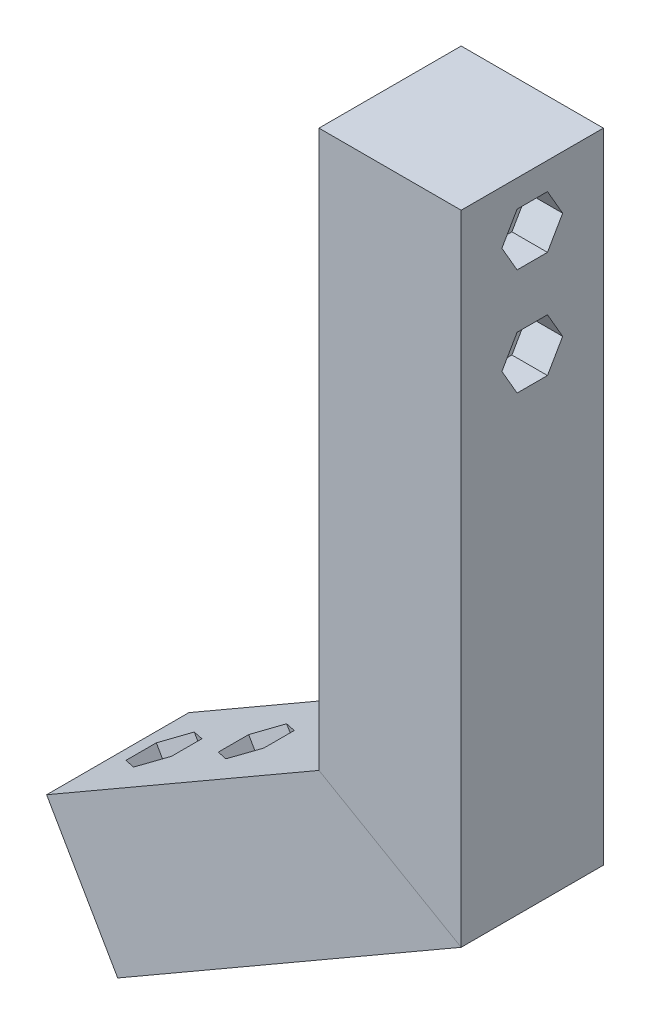
from build123d import *

# Parameters (mm, degrees)
SKETCH4_W          = 20
SKETCH4_H          = 20
CUT_EXTRUDE1_REACH = 118.478
SKETCH5_R          = 2
SKETCH5_3_R        = 2
CUT_EXTRUDE2_DEPTH = 5
SKETCH6_R          = 2
CUT_EXTRUDE3_DEPTH = 139.877964102
SKETCH6_5_R        = 2
CUT_EXTRUDE4_DEPTH = 5


with BuildPart() as part:
    # Sweep1: sweep along a path in Sketch1
    with BuildLine(Plane.XY) as sweep1_path:
        Line((0, 0), (43.301270189, 25))
        Line((43.301270189, 25), (43.301270189, 109))
    # Sketch4 → Sweep1 (sweep)
    with BuildSketch(Plane(origin=(0, 0, 0), x_dir=(0, 0, 1), z_dir=(-0.866025403784438, -0.5000000000000012, 0))):
        Rectangle(SKETCH4_W, SKETCH4_H)
    sweep(path=sweep1_path.line, transition=Transition.RIGHT)

    # Sketch5 → Cut-Extrude1 (cut, up to next)
    with BuildSketch(Plane(origin=(-5, 8.660254038, 0), x_dir=(0.866025403784438, 0.5000000000000012, 0), z_dir=(-0.5000000000000012, 0.866025403784438, 0)), mode=Mode.PRIVATE) as cut_extrude1_sk1:
        with Locations(Location((7.5, 0, 0), (0, 0, 180))):
            Circle(SKETCH5_R)
    cut_extrude1_tool1 = extrude(cut_extrude1_sk1.sketch, amount=-CUT_EXTRUDE1_REACH, mode=Mode.PRIVATE) & part.part
    # Sketch5 → Cut-Extrude1 (cut, up to next)
    with BuildSketch(Plane(origin=(-5, 8.660254038, 0), x_dir=(0.866025403784438, 0.5000000000000012, 0), z_dir=(-0.5000000000000012, 0.866025403784438, 0)), mode=Mode.PRIVATE) as cut_extrude1_sk2:
        with Locations(Location((22.5, 0, 0), (0, 0, 180))):
            Circle(SKETCH5_R)
    cut_extrude1_tool2 = extrude(cut_extrude1_sk2.sketch, amount=-CUT_EXTRUDE1_REACH, mode=Mode.PRIVATE) & part.part
    add(cut_extrude1_tool1.solids().sort_by_distance((1.495191, 12.410254, 0))[0], mode=Mode.SUBTRACT)
    add(cut_extrude1_tool2.solids().sort_by_distance((14.485572, 19.910254, 0))[0], mode=Mode.SUBTRACT)

    # Sketch5<3> → Cut-Extrude2 (cut)
    # profile 1 of 2: a face of its own
    with BuildSketch(Plane(origin=(-5, 8.660254038, 0), x_dir=(0.866025403784438, 0.5000000000000012, 0), z_dir=(-0.5000000000000012, 0.866025403784438, 0))):
        Polygon((11.2, -2.136195996), (11.2, 2.136195996), (7.5, 4.272391992), (3.8, 2.136195996), (3.8, -2.136195996), (7.5, -4.272391992), align=None)
        with Locations(Location((7.5, 0, 0), (0, 0, 180))):
            Circle(SKETCH5_3_R, mode=Mode.SUBTRACT)
    # profile 2 of 2: a face of its own
    with BuildSketch(Plane(origin=(-5, 8.660254038, 0), x_dir=(0.866025403784438, 0.5000000000000012, 0), z_dir=(-0.5000000000000012, 0.866025403784438, 0))):
        Polygon((26.2, -2.136195996), (26.2, 2.136195996), (22.5, 4.272391992), (18.8, 2.136195996), (18.8, -2.136195996), (22.5, -4.272391992), align=None)
        with Locations(Location((22.5, 0, 0), (0, 0, 180))):
            Circle(SKETCH5_3_R, mode=Mode.SUBTRACT)
    extrude(amount=-CUT_EXTRUDE2_DEPTH, mode=Mode.SUBTRACT)

    # Sketch6 → Cut-Extrude3 (cut, through all)
    with BuildSketch(Plane(origin=(53.301270189, 0, -53.301270189), x_dir=(0, 0, 1), z_dir=(-1, 0, 0))):
        with Locations(Location((53.301270189, 101.5, 0), (0, 0, 90))):
            Circle(SKETCH6_R)
        with Locations(Location((53.301270189, 86.5, 0), (0, 0, 90))):
            Circle(SKETCH6_R)
    extrude(amount=CUT_EXTRUDE3_DEPTH, mode=Mode.SUBTRACT)

    # Sketch6<5> → Cut-Extrude4 (cut)
    # profile 1 of 2: a face of its own
    with BuildSketch(Plane(origin=(53.301270189, 0, -53.301270189), x_dir=(0, 0, 1), z_dir=(-1, 0, 0))):
        Polygon((55.437466185, 97.8), (57.573662181, 101.5), (55.437466185, 105.2), (51.165074193, 105.2), (49.028878197, 101.5), (51.165074193, 97.8), align=None)
        with Locations(Location((53.301270189, 101.5, 0), (0, 0, 90))):
            Circle(SKETCH6_5_R, mode=Mode.SUBTRACT)
    # profile 2 of 2: a face of its own
    with BuildSketch(Plane(origin=(53.301270189, 0, -53.301270189), x_dir=(0, 0, 1), z_dir=(-1, 0, 0))):
        Polygon((55.437466185, 82.8), (57.573662181, 86.5), (55.437466185, 90.2), (51.165074193, 90.2), (49.028878197, 86.5), (51.165074193, 82.8), align=None)
        with Locations(Location((53.301270189, 86.5, 0), (0, 0, 90))):
            Circle(SKETCH6_5_R, mode=Mode.SUBTRACT)
    extrude(amount=CUT_EXTRUDE4_DEPTH, mode=Mode.SUBTRACT)


solid = part.part
